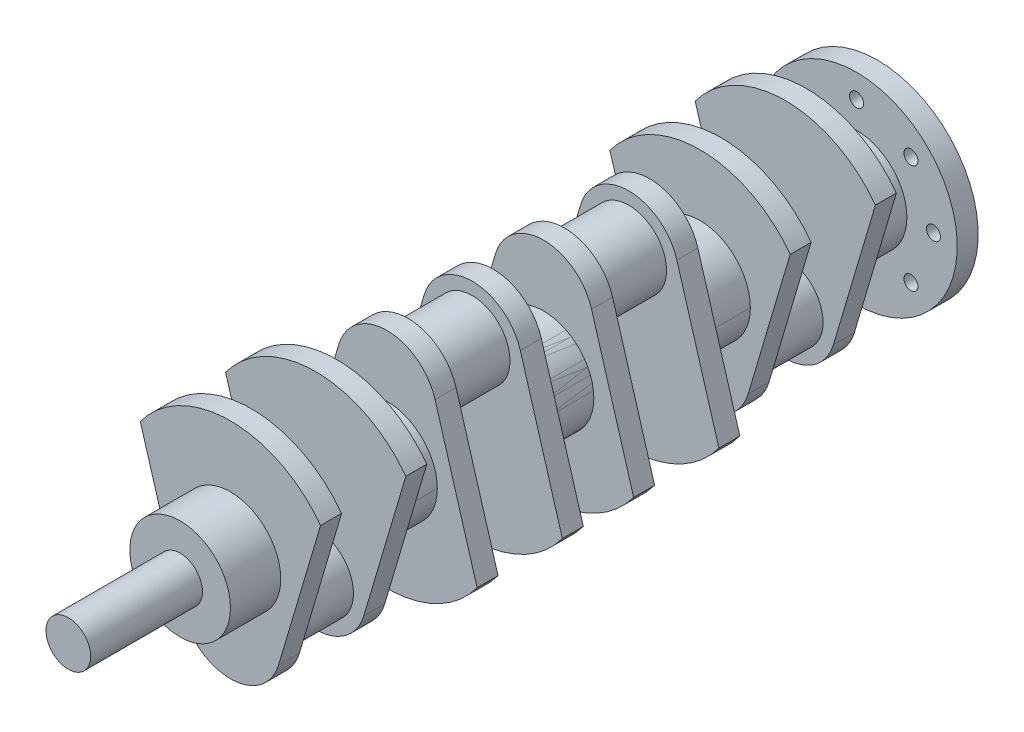
from build123d import *

# Parameters (mm, degrees)
SKETCH1_R             = 35.885265696
BOSS_EXTRUDE1_DEPTH   = 15
SKETCH4_R             = 27
BOSS_EXTRUDE2_DEPTH   = 46
SKETCH6_R             = 36
BOSS_EXTRUDE3_DEPTH   = 36
BODY_MOVE_COPY2_ANGLE = 180
SKETCH8_R             = 16
BOSS_EXTRUDE5_DEPTH   = 80
SKETCH9_R             = 72
BOSS_EXTRUDE6_DEPTH   = 15
SKETCH10_R            = 5
CUT_EXTRUDE2_DEPTH    = 15


with BuildPart() as part:
    # Sketch1 → Boss-Extrude1 (new body)
    with BuildSketch(Plane.XY):
        with BuildLine():
            ThreePointArc((64.484675932, 47.346874976), (0, 80), (-64.484675932, 47.346874976))
            Line((-64.484675932, 47.346874976), (-34.40750094, -54.191966106))
            ThreePointArc((-34.40750094, -54.191966106), (-5.149270866, -8.486097037), (35.885265696, -44))
            ThreePointArc((35.885265696, -44), (35.513902963, -49.149270866), (34.40750094, -54.191966106))
            Line((34.40750094, -54.191966106), (64.484675932, 47.346874976))
        make_face()
        with Locations((0, -44)):
            Circle(SKETCH1_R)
    boss_extrude1 = extrude(amount=BOSS_EXTRUDE1_DEPTH)

    # Sketch4 → Boss-Extrude2 (add)
    with BuildSketch(Plane(origin=(0, 0, 0), x_dir=(-1, 0, 0), z_dir=(0, 0, -1))):
        with Locations(Location((0, -44, 0), (0, 0, 180))):
            Circle(SKETCH4_R)
    extrude(amount=BOSS_EXTRUDE2_DEPTH)

    # Mirror1: Boss-Extrude1 across plane
    add(boss_extrude1.mirror(Plane(origin=(0, 0, -23), x_dir=(1, 0, 0), z_dir=(0, 0, -1))))

    # Sketch6 → Boss-Extrude3 (add)
    with BuildSketch(Plane.XY.offset(15)):
        Circle(SKETCH6_R)
    boss_extrude3 = extrude(amount=BOSS_EXTRUDE3_DEPTH)

    # Mirror2: Boss-Extrude3 across plane
    add(boss_extrude3.mirror(Plane(origin=(0, 0, -23), x_dir=(1, 0, 0), z_dir=(0, 0, -1))))


with BuildPart() as body_2:
    # Mirror13: mirrored copy
    add(part.part.mirror(Plane(origin=(0, 0, -79), x_dir=(1, 0, 0), z_dir=(0, 0, -1))))


with BuildPart() as body_2_1:
    # Body-Move/Copy2: moved
    add(body_2.part.rotate(Axis((0, 0.057367152, -135), (1, 0, 0)), BODY_MOVE_COPY2_ANGLE))


with BuildPart() as body_3:
    # Mirror15: mirrored copy
    add(part.part.mirror(Plane(origin=(0, 0, -191), x_dir=(1, 0, 0), z_dir=(0, 0, -1))))

    # Sketch9 → Boss-Extrude6 (add)
    with BuildSketch(Plane(origin=(0, 0, -433), x_dir=(-1, 0, 0), z_dir=(0, 0, -1))):
        with Locations(Location((0, 0, 0), (0, 0, 90))):
            Circle(SKETCH9_R)
    extrude(amount=BOSS_EXTRUDE6_DEPTH)

    # Sketch10 → Cut-Extrude2 (cut)
    with BuildSketch(Plane(origin=(0, 0, -448), x_dir=(-1, 0, 0), z_dir=(0, 0, -1))):
        with Locations(Location((0, 55, 0), (0, 0, 90))):
            Circle(SKETCH10_R)
        with Locations(Location((38.890872965, 38.890872965, 0), (0, 0, 90))):
            Circle(SKETCH10_R)
        with Locations(Location((55, 0, 0), (0, 0, 90))):
            Circle(SKETCH10_R)
        with Locations(Location((38.890872965, -38.890872965, 0), (0, 0, 90))):
            Circle(SKETCH10_R)
        with Locations(Location((0, -55, 0), (0, 0, 90))):
            Circle(SKETCH10_R)
        with Locations(Location((-38.890872965, -38.890872965, 0), (0, 0, 90))):
            Circle(SKETCH10_R)
        with Locations(Location((-55, 0, 0), (0, 0, 90))):
            Circle(SKETCH10_R)
        with Locations(Location((-38.890872965, 38.890872965, 0), (0, 0, 90))):
            Circle(SKETCH10_R)
    extrude(amount=-CUT_EXTRUDE2_DEPTH, mode=Mode.SUBTRACT)


with BuildPart() as body_4:
    # Mirror15 2: mirrored copy
    add(body_2_1.part.mirror(Plane(origin=(0, 0, -191), x_dir=(1, 0, 0), z_dir=(0, 0, -1))))


with BuildPart() as part_1:
    add(part.part)

    # Sketch8 → Boss-Extrude5 (add)
    with BuildSketch(Plane.XY.offset(51)):
        Circle(SKETCH8_R)
    extrude(amount=BOSS_EXTRUDE5_DEPTH)


solid = Compound([body_2_1.part, body_3.part, body_4.part, part_1.part])
